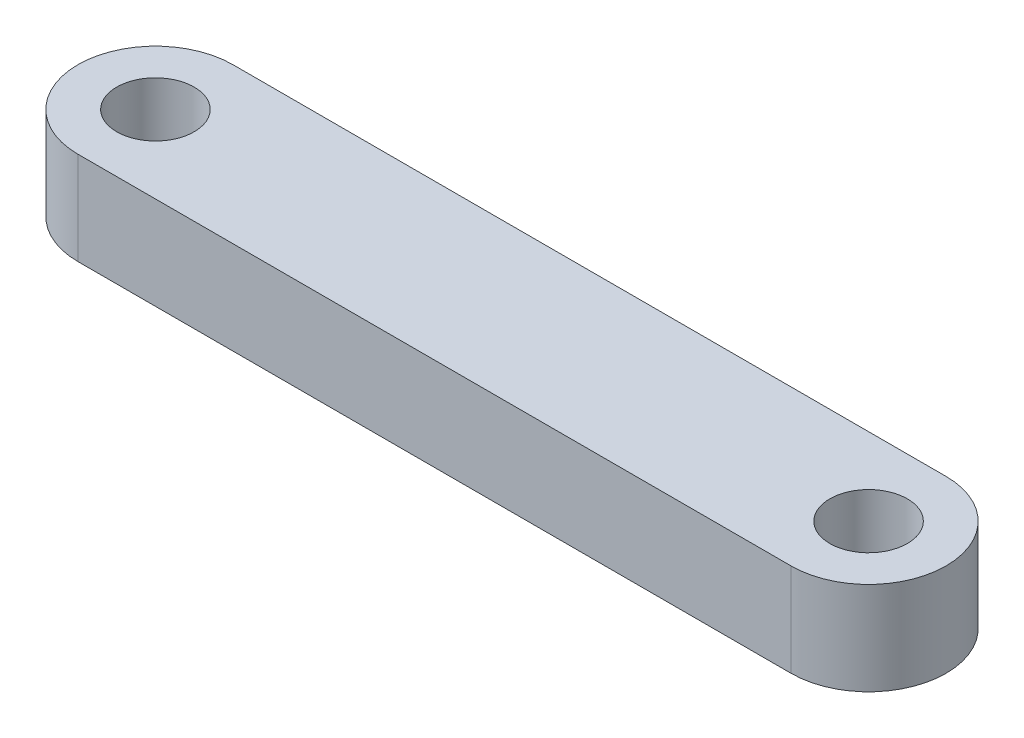
from build123d import *

# Parameters (mm, degrees)
BOSS_EXTRUDE1_DEPTH = 3
SKETCH2_R           = 1.25
CUT_EXTRUDE1_DEPTH  = 15.534441854


with BuildPart() as part:
    # Sketch1 → Boss-Extrude1 (new body)
    with BuildSketch(Plane(origin=(0, 0, 0), x_dir=(1, 0, 0), z_dir=(0, 1, 0))):
        with BuildLine():
            Line((11.5, -2.5), (-11.5, -2.5))
            ThreePointArc((-11.5, -2.5), (-14, 0), (-11.5, 2.5))
            Line((-11.5, 2.5), (11.5, 2.5))
            ThreePointArc((11.5, 2.5), (14, 0), (11.5, -2.5))
        make_face()
    extrude(amount=BOSS_EXTRUDE1_DEPTH)

    # Sketch2 → Cut-Extrude1 (cut, through all)
    with BuildSketch(Plane(origin=(0, 3, 0), x_dir=(1, 0, 0), z_dir=(0, 1, 0))):
        with Locations(Location((11.5, 0, 0), (0, 0, 270))):
            Circle(SKETCH2_R)
        with Locations(Location((-11.5, 0, 0), (0, 0, 270))):
            Circle(SKETCH2_R)
    extrude(amount=-CUT_EXTRUDE1_DEPTH, mode=Mode.SUBTRACT)


solid = part.part
